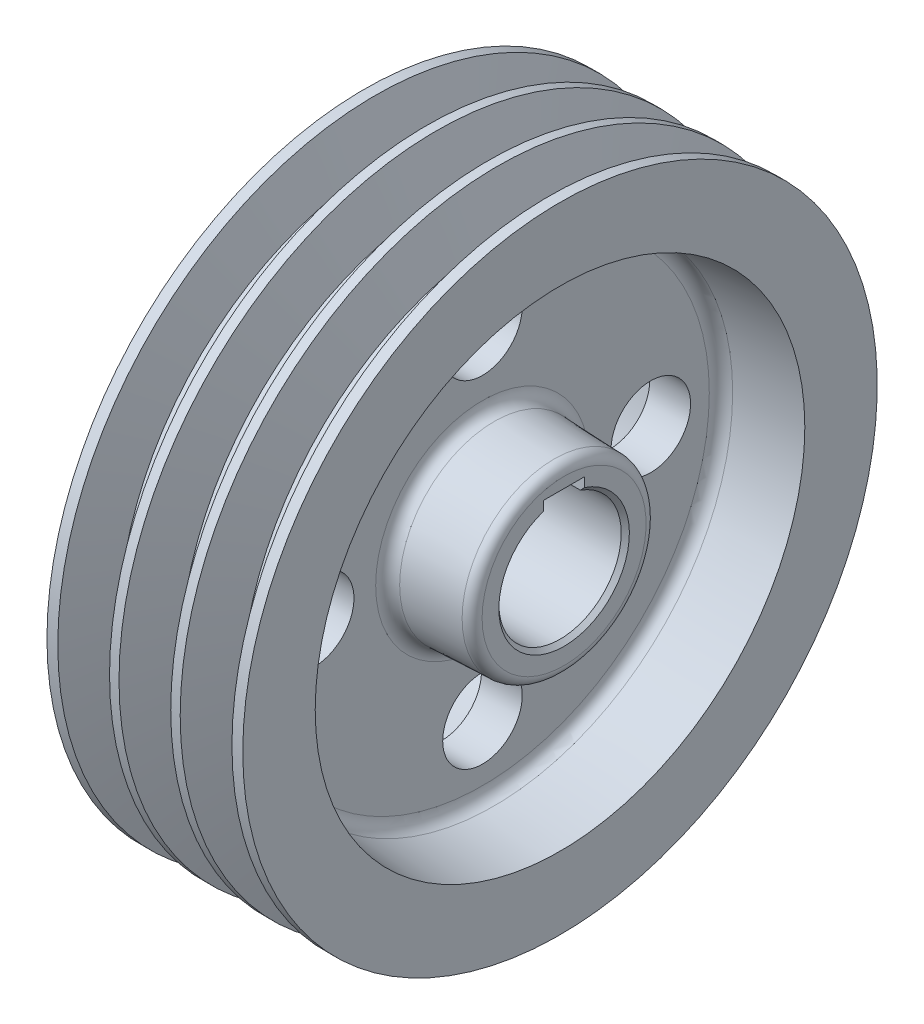
from build123d import *

# Parameters (mm, degrees)
PATTERN_LINEAR_961_COUNT    = 3
PATTERN_LINEAR_961_PITCH    = 15
CHAMFER_1_SIZE              = 1
SKETCH_4_W                  = 10
SKETCH_4_H                  = 3.357864376
CUT_EXTRUDE_1_DEPTH         = 121.789589783
FILLET_1_R                  = 3
FILLET_2_R                  = 2.5
SKETCH_5_R                  = 9.75
CUT_EXTRUDE_2_DEPTH         = 121.379088716
PATTERN_CIRCULAR_1909_COUNT = 4


with BuildPart() as part:
    # 草图1 → 旋转1 (revolve)
    with BuildSketch(Plane.XY, mode=Mode.PRIVATE) as revolve_1_sk:
        Polygon((-1, 15), (-1, 22.5), (19, 24.249773271), (19, 59.240202621), (0, 60), (0, 77.75), (48, 77.75), (48, 60), (29, 58.337715393), (29, 23.299786714), (49, 22.5), (49, 15), align=None)
    revolve(revolve_1_sk.sketch.rotate(Axis((0, 0, 0), (1, 0, 0)), 90), axis=Axis((0, 0, 0), (1, 0, 0)))

    # 草图2 → 切除-旋转1 (revolve, cut)
    with BuildSketch(Plane.XY, mode=Mode.PRIVATE) as cut_revolve_1_sk:
        Polygon((11.840143071, 66.3), (15.340759374, 77.75), (2.659240626, 77.75), (6.159856929, 66.3), align=None)
    cut_revolve_1 = revolve(cut_revolve_1_sk.sketch.rotate(Axis((0, 0, 0), (1, 0, 0)), 90), axis=Axis((0, 0, 0), (1, 0, 0)), mode=Mode.SUBTRACT)

    # Pattern Linear 961: 切除-旋转1 ×3
    with Locations(*[(i * PATTERN_LINEAR_961_PITCH, 0, 0) for i in range(1, PATTERN_LINEAR_961_COUNT)]):
        add(cut_revolve_1, mode=Mode.SUBTRACT)

    # 倒角1
    chamfer_1_edges = [part.edges().sort_by_distance(p)[0] for p in [
        (-1, 0, -15),
        (49, 0, -15),
    ]]
    chamfer(chamfer_1_edges, length=CHAMFER_1_SIZE)

    # 草图4 → 切除-拉伸1 (cut, through all)
    with BuildSketch(Plane.ZY.offset(1)):
        with Locations((0, 15.821067812)):
            Rectangle(SKETCH_4_W, SKETCH_4_H)
    extrude(amount=-CUT_EXTRUDE_1_DEPTH, mode=Mode.SUBTRACT)

    # 圆角1
    fillet_1_edges = [part.edges().sort_by_distance(p)[0] for p in [
        (19, 0, -59.240202621),
        (19, 0, -24.249773271),
        (29, 0, -23.299786714),
        (29, 0, -58.337715393),
    ]]
    fillet(fillet_1_edges, radius=FILLET_1_R)

    # 圆角2
    fillet_2_edges = [part.edges().sort_by_distance(p)[0] for p in [
        (-1, 0, -22.5),
        (49, 0, -22.5),
    ]]
    fillet(fillet_2_edges, radius=FILLET_2_R)

    # 草图5 → 切除-拉伸2 (cut, through all)
    with BuildSketch(Plane(origin=(0, 0, 0), x_dir=(0, 0, -1), z_dir=(1, 0, 0))):
        with Locations(Location((0, 41.25, 0), (0, 0, 180))):
            Circle(SKETCH_5_R)
    cut_extrude_2 = extrude(amount=CUT_EXTRUDE_2_DEPTH, mode=Mode.SUBTRACT)

    # Pattern Circular 1909: 切除-拉伸2 ×4 about axis
    pattern_circular_1909_axis = Axis((0, 0, 0), (1, 0, 0))
    for i in range(1, PATTERN_CIRCULAR_1909_COUNT):
        add(cut_extrude_2.rotate(pattern_circular_1909_axis, i * 360 / PATTERN_CIRCULAR_1909_COUNT), mode=Mode.SUBTRACT)


solid = part.part
